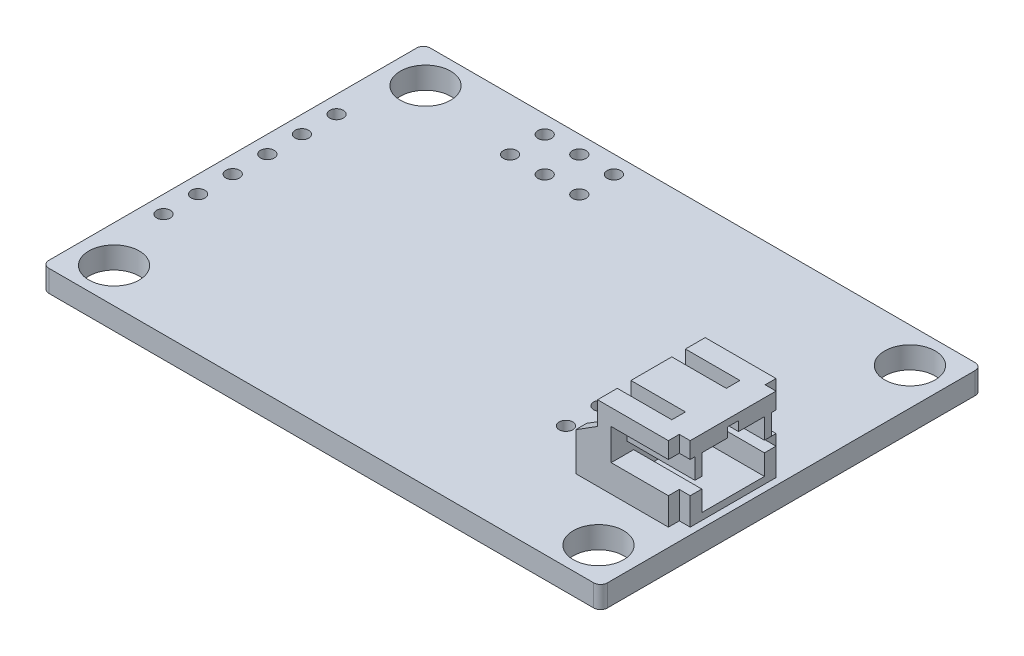
from build123d import *

# Parameters (mm, degrees)
SKETCH1_W           = 41
SKETCH1_H           = 28
SKETCH1_R           = 1.85
BOARD_DEPTH         = 1.6
SKETCH4_R           = 0.5
HOLES_DEPTH         = 25.875891944
FILLET1_R           = 0.5
SKETCH5_W           = 6
SKETCH5_H           = 3.95
BOSS_EXTRUDE2_DEPTH = 5.5
BOSS_EXTRUDE3_DEPTH = 0.8
CUT_EXTRUDE2_DEPTH  = 5
SKETCH7_W           = 4
SKETCH7_H           = 1
CUT_EXTRUDE3_DEPTH  = 1
SKETCH9_W           = 0.8
SKETCH9_H           = 0.8
CUT_EXTRUDE4_DEPTH  = 26.819759875


with BuildPart() as part:
    # Sketch1 → board (new body)
    with BuildSketch(Plane(origin=(0, 0, 0), x_dir=(1, 0, 0), z_dir=(0, 1, 0))):
        Rectangle(SKETCH1_W, SKETCH1_H)
        with Locations(Location((-17.78, 11.43, 0), (0, 0, 270))):
            Circle(SKETCH1_R, mode=Mode.SUBTRACT)
        with Locations(Location((-17.78, -11.43, 0), (0, 0, 270))):
            Circle(SKETCH1_R, mode=Mode.SUBTRACT)
        with Locations(Location((17.78, -11.43, 0), (0, 0, 270))):
            Circle(SKETCH1_R, mode=Mode.SUBTRACT)
        with Locations(Location((17.78, 11.43, 0), (0, 0, 270))):
            Circle(SKETCH1_R, mode=Mode.SUBTRACT)
    extrude(amount=BOARD_DEPTH)

    # Sketch4 → holes (cut, through all)
    with BuildSketch(Plane(origin=(0, 0, 0), x_dir=(1, 0, 0), z_dir=(0, 1, 0))):
        with Locations(Location((-19.23, -6.35, 0), (0, 0, 270))):
            Circle(SKETCH4_R)
        with Locations(Location((-19.23, -3.81, 0), (0, 0, 270))):
            Circle(SKETCH4_R)
        with Locations(Location((-19.23, -1.27, 0), (0, 0, 270))):
            Circle(SKETCH4_R)
        with Locations(Location((-19.23, 1.27, 0), (0, 0, 270))):
            Circle(SKETCH4_R)
        with Locations(Location((-19.23, 3.81, 0), (0, 0, 270))):
            Circle(SKETCH4_R)
        with Locations(Location((-19.23, 6.35, 0), (0, 0, 270))):
            Circle(SKETCH4_R)
        with Locations(Location((-5.22, 10.16, 0), (0, 0, 270))):
            Circle(SKETCH4_R)
        with Locations(Location((-7.76, 10.16, 0), (0, 0, 270))):
            Circle(SKETCH4_R)
        with Locations(Location((-5.22, 12.7, 0), (0, 0, 270))):
            Circle(SKETCH4_R)
        with Locations(Location((-7.76, 12.7, 0), (0, 0, 270))):
            Circle(SKETCH4_R)
        with Locations(Location((-10.3, 12.7, 0), (0, 0, 270))):
            Circle(SKETCH4_R)
        with Locations(Location((9, -5.04, 0), (0, 0, 270))):
            Circle(SKETCH4_R)
        with Locations(Location((9, -2.5, 0), (0, 0, 270))):
            Circle(SKETCH4_R)
        with Locations(Location((-10.3, 10.16, 0), (0, 0, 270))):
            Circle(SKETCH4_R)
    extrude(amount=HOLES_DEPTH, mode=Mode.SUBTRACT)

    # Fillet1
    fillet1_edges = [part.edges().sort_by_distance(p)[0] for p in [
        (20.5, 0.8, -14),
        (20.5, 0.8, 14),
        (-20.5, 0.8, 14),
        (-20.5, 0.8, -14),
    ]]
    fillet(fillet1_edges, radius=FILLET1_R)


with BuildPart() as body_2:
    # Sketch5 → Boss-Extrude2 (new body)
    with BuildSketch(Plane(origin=(0, 1.6, 0), x_dir=(1, 0, 0), z_dir=(0, 1, 0))):
        with Locations((17, -5.745)):
            Rectangle(SKETCH5_W, SKETCH5_H)
    extrude(amount=BOSS_EXTRUDE2_DEPTH)

    # Sketch8 → Boss-Extrude3 (add)
    with BuildSketch(Plane.XY.offset(7.72)):
        Polygon((12.4, 1.6), (12.4, 4.4), (14, 5.4), (14, 1.6), align=None)
    extrude(amount=-BOSS_EXTRUDE3_DEPTH)

    # Sketch6 → Cut-Extrude2 (cut)
    with BuildSketch(Plane(origin=(20, 0, 0), x_dir=(0, 0, -1), z_dir=(1, 0, 0))):
        Polygon((-6.07, 5.9), (-4.17, 5.9), (-4.17, 6.6), (-3.77, 6.6), (-3.77, 2.1), (-6.07, 2.1), (-6.07, 3.6), (-7.72, 3.6), (-7.72, 5.9), (-6.57, 5.9), (-6.57, 4.4), (-6.07, 4.4), align=None)
    extrude(amount=-CUT_EXTRUDE2_DEPTH, mode=Mode.SUBTRACT)

    # Sketch7 → Cut-Extrude3 (cut)
    with BuildSketch(Plane(origin=(0, 7.1, 0), x_dir=(1, 0, 0), z_dir=(0, 1, 0))):
        with Locations((16, -5.77)):
            Rectangle(SKETCH7_W, SKETCH7_H)
    extrude(amount=-CUT_EXTRUDE3_DEPTH, mode=Mode.SUBTRACT)

    # Sketch9 → Cut-Extrude4 (cut, through all)
    with BuildSketch(Plane(origin=(0, 7.1, 0), x_dir=(1, 0, 0), z_dir=(0, 1, 0))):
        with Locations((19.6, -7.32)):
            Rectangle(SKETCH9_W, SKETCH9_H)
    extrude(amount=-CUT_EXTRUDE4_DEPTH, mode=Mode.SUBTRACT)

    # Mirror1: body 2 across plane


with BuildPart() as body_2_1:
    add(body_2.part)
    add(body_2.part.mirror(Plane(origin=(14, 7.1, 3.77), x_dir=(1, 0, 0), z_dir=(0, 0, 1))))


solid = Compound([part.part, body_2_1.part])
